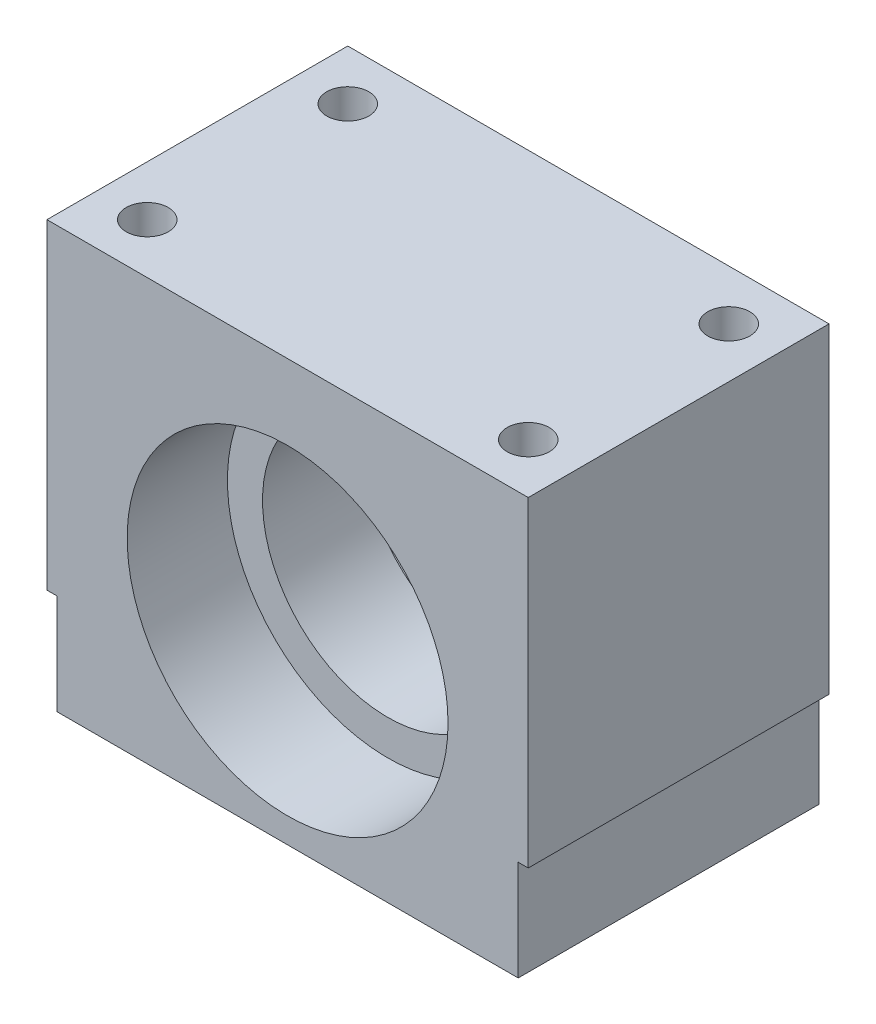
from build123d import *

# Parameters (mm, degrees)
SZKIC1_W                       = 48
SZKIC1_H                       = 30
DODANIE_WYCI_GNI_CIE1_DEPTH    = 42
SZKIC3_R                       = 12.5
WYTNIJ_WYCI_GNI_CIE2_DEPTH     = 57.920997883
SZKIC4_R                       = 16
WYTNIJ_WYCI_GNI_CIE3_DEPTH     = 10
OTW_R_GWINTOWANY_M5X0_81_D     = 4.2
OTW_R_GWINTOWANY_M5X0_81_DEPTH = 35
OTW_R_GWINTOWANY_M5X0_81_TIP   = 1.2618073
SZKIC10_W                      = 1
SZKIC10_H                      = 10
WYTNIJ_WYCI_GNI_CIE4_DEPTH     = 57.920997883


with BuildPart() as part:
    # Szkic1 → Dodanie-wyciągnięcie1 (new body)
    with BuildSketch(Plane(origin=(0, 0, 0), x_dir=(1, 0, 0), z_dir=(0, 1, 0))):
        Rectangle(SZKIC1_W, SZKIC1_H)
    extrude(amount=DODANIE_WYCI_GNI_CIE1_DEPTH)

    # Szkic3 → Wytnij-wyciągnięcie2 (cut, through all)
    with BuildSketch(Plane.XY.offset(15)):
        with Locations((0, 18.5)):
            Circle(SZKIC3_R)
    extrude(amount=-WYTNIJ_WYCI_GNI_CIE2_DEPTH, mode=Mode.SUBTRACT)

    # Szkic4 → Wytnij-wyciągnięcie3 (cut)
    with BuildSketch(Plane.XY.offset(15)):
        with Locations((0, 18.5)):
            Circle(SZKIC4_R)
    wytnij_wyci_gni_cie3 = extrude(amount=-WYTNIJ_WYCI_GNI_CIE3_DEPTH, mode=Mode.SUBTRACT)

    # Lustro1: Wytnij-wyciągnięcie3 across plane
    add(wytnij_wyci_gni_cie3.mirror(Plane.XY), mode=Mode.SUBTRACT)

    # Otwór gwintowany M5x0.81
    with Locations(Plane(origin=(0, 42, 0), x_dir=(1, 0, 0), z_dir=(0, 1, 0))):
        with Locations((-19, -10), (-19, 10), (19, -10), (19, 10)):
            Hole(OTW_R_GWINTOWANY_M5X0_81_D / 2, depth=OTW_R_GWINTOWANY_M5X0_81_DEPTH)
            with Locations((0, 0, -(OTW_R_GWINTOWANY_M5X0_81_DEPTH + OTW_R_GWINTOWANY_M5X0_81_TIP / 2))):  # 118° drill point
                Cone(0, OTW_R_GWINTOWANY_M5X0_81_D / 2, OTW_R_GWINTOWANY_M5X0_81_TIP, mode=Mode.SUBTRACT)

    # Szkic10 → Wytnij-wyciągnięcie4 (cut, through all)
    with BuildSketch(Plane.XY.offset(15)):
        with Locations((23.5, 5)):
            Rectangle(SZKIC10_W, SZKIC10_H)
        with Locations((-23.5, 5)):
            Rectangle(SZKIC10_W, SZKIC10_H)
    extrude(amount=-WYTNIJ_WYCI_GNI_CIE4_DEPTH, mode=Mode.SUBTRACT)


solid = part.part
